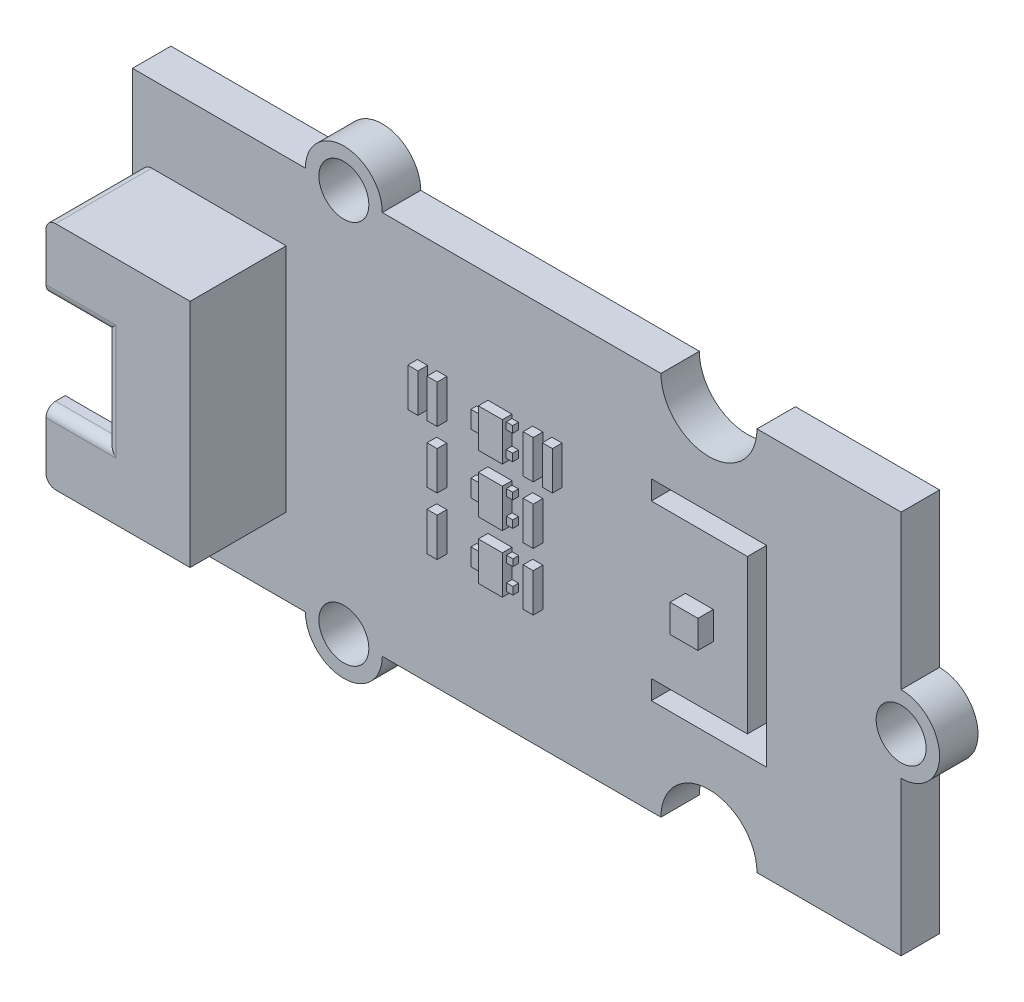
from build123d import *

# Parameters (mm, degrees)
SKETCH1_R           = 1.3
BOSS_EXTRUDE1_DEPTH = 2
BOSS_EXTRUDE2_DEPTH = 5
SKETCH3_W           = 4
SKETCH3_H           = 10
CUT_EXTRUDE1_DEPTH  = 7
SKETCH4_W           = 5
SKETCH4_H           = 12
CUT_EXTRUDE2_DEPTH  = 0.5
CUT_EXTRUDE3_DEPTH  = 1.5
FILLET1_R           = 0.5
SKETCH6_W           = 1.450763296
SKETCH6_H           = 1.450763296
BOSS_EXTRUDE3_DEPTH = 0.8
SKETCH7_W           = 0.528041157
SKETCH7_H           = 2.003611801
BOSS_EXTRUDE4_DEPTH = 0.5
SKETCH8_W           = 1.250632541
SKETCH8_H           = 2.003611801
BOSS_EXTRUDE5_DEPTH = 0.5
SKETCH9_W           = 0.587023474
SKETCH9_H           = 0.894026868
SKETCH9_W_2         = 0.333695167
SKETCH9_H_2         = 0.350698787
SKETCH9_W_3         = 0.333695166
SKETCH9_H_3         = 0.390012219
SKETCH9_H_4         = 0.39001222
SKETCH9_H_5         = 0.350698788
BOSS_EXTRUDE6_DEPTH = 0.3


with BuildPart() as part:
    # Sketch1 → Boss-Extrude1 (new body)
    with BuildSketch(Plane.XY):
        with BuildLine():
            Line((0, 0), (9, 0))
            ThreePointArc((9, 0), (11, -2), (13, 0))
            Line((13, 0), (27.5, 0))
            ThreePointArc((27.5, 0), (30, 2.5), (32.5, 0))
            Line((32.5, 0), (40, 0))
            Line((40, 0), (40, 8))
            ThreePointArc((40, 8), (42, 10), (40, 12))
            Line((40, 12), (40, 20))
            Line((40, 20), (32.5, 20))
            ThreePointArc((32.5, 20), (30, 17.5), (27.5, 20))
            Line((27.5, 20), (13, 20))
            ThreePointArc((13, 20), (11, 22), (9, 20))
            Line((9, 20), (0, 20))
            Line((0, 20), (0, 0))
        make_face()
        with Locations((11, 20)):
            Circle(SKETCH1_R, mode=Mode.SUBTRACT)
        with Locations((11, 0)):
            Circle(SKETCH1_R, mode=Mode.SUBTRACT)
        with Locations((40, 10)):
            Circle(SKETCH1_R, mode=Mode.SUBTRACT)
        Polygon((33, 15), (27, 15), (27, 14), (32, 14), (32, 6), (27, 6), (27, 5), (33, 5), align=None, mode=Mode.SUBTRACT)
    extrude(amount=BOSS_EXTRUDE1_DEPTH)

    # Sketch2 → Boss-Extrude2 (add)
    with BuildSketch(Plane.XY.offset(2)):
        Polygon((0, 10), (0, 16), (8, 16), (8, 4), (0, 4), align=None)
    extrude(amount=BOSS_EXTRUDE2_DEPTH)

    # Sketch3 → Cut-Extrude1 (cut)
    with BuildSketch(Plane.ZY):
        with Locations((4, 10)):
            Rectangle(SKETCH3_W, SKETCH3_H)
    extrude(amount=-CUT_EXTRUDE1_DEPTH, mode=Mode.SUBTRACT)

    # Sketch4 → Cut-Extrude2 (cut)
    with BuildSketch(Plane.ZY):
        with Locations((4.5, 10)):
            Rectangle(SKETCH4_W, SKETCH4_H)
    extrude(amount=-CUT_EXTRUDE2_DEPTH, mode=Mode.SUBTRACT)

    # Sketch5 → Cut-Extrude3 (cut)
    with BuildSketch(Plane.XY.offset(7)):
        Polygon((3.638822155, 12.5), (0.5, 12.5), (0.5, 10), (0.5, 7.5), (3.638822155, 7.5), align=None)
    extrude(amount=-CUT_EXTRUDE3_DEPTH, mode=Mode.SUBTRACT)

    # Fillet1
    fillet1_edges = [part.edges().sort_by_distance(p)[0] for p in [
        (0.5, 4, 4.5),
        (0.5, 16, 4.5),
        (2.069411077, 7.5, 7),
        (3.638822155, 10, 7),
        (2.069411077, 12.5, 7),
    ]]
    fillet(fillet1_edges, radius=FILLET1_R)

    # Sketch6 → Boss-Extrude3 (add)
    with BuildSketch(Plane.XY.offset(2)):
        with Locations((29.5, 10)):
            Rectangle(SKETCH6_W, SKETCH6_H)
    extrude(amount=BOSS_EXTRUDE3_DEPTH)

    # Sketch7 → Boss-Extrude4 (add)
    with BuildSketch(Plane.XY.offset(2)):
        with Locations((16.091644497, 13.2872497)):
            Rectangle(SKETCH7_W, SKETCH7_H)
        with Locations((15.091644497, 13.2872497)):
            Rectangle(SKETCH7_W, SKETCH7_H)
        with Locations((16.091644497, 10.2872497)):
            Rectangle(SKETCH7_W, SKETCH7_H)
        with Locations((16.091644497, 7.2872497)):
            Rectangle(SKETCH7_W, SKETCH7_H)
        with Locations((22.091644497, 13.2872497)):
            Rectangle(SKETCH7_W, SKETCH7_H)
        with Locations((21.091644497, 13.2872497)):
            Rectangle(SKETCH7_W, SKETCH7_H)
        with Locations((21.091644497, 10.2872497)):
            Rectangle(SKETCH7_W, SKETCH7_H)
        with Locations((21.091644497, 7.2872497)):
            Rectangle(SKETCH7_W, SKETCH7_H)
    extrude(amount=BOSS_EXTRUDE4_DEPTH)

    # Sketch8 → Boss-Extrude5 (add)
    with BuildSketch(Plane.XY.offset(2)):
        with Locations((19.1224917, 10.2872497)):
            Rectangle(SKETCH8_W, SKETCH8_H)
        with Locations((19.1224917, 13.2872497)):
            Rectangle(SKETCH8_W, SKETCH8_H)
        with Locations((19.1224917, 7.2872497)):
            Rectangle(SKETCH8_W, SKETCH8_H)
    extrude(amount=BOSS_EXTRUDE5_DEPTH)

    # Sketch9 → Boss-Extrude6 (add)
    with BuildSketch(Plane.XY.offset(2)):
        with Locations((18.203663692, 13.292407159)):
            Rectangle(SKETCH9_W, SKETCH9_H)
        with Locations((18.203663692, 10.192407159)):
            Rectangle(SKETCH9_W, SKETCH9_H)
        with Locations((18.203663692, 7.092407159)):
            Rectangle(SKETCH9_W, SKETCH9_H)
        with Locations((19.914655554, 13.914769987)):
            Rectangle(SKETCH9_W_2, SKETCH9_H_2)
        with Locations((19.921649724, 9.650395769)):
            Rectangle(SKETCH9_W_3, SKETCH9_H_3)
        with Locations((19.914655554, 12.650387615)):
            Rectangle(SKETCH9_W_2, SKETCH9_H_4)
        with Locations((19.921649724, 10.91477814)):
            Rectangle(SKETCH9_W_3, SKETCH9_H_5)
        with Locations((19.928643894, 6.650403922)):
            Rectangle(SKETCH9_W_3, SKETCH9_H_3)
        with Locations((19.928643894, 7.914786293)):
            Rectangle(SKETCH9_W_3, SKETCH9_H_5)
    extrude(amount=BOSS_EXTRUDE6_DEPTH)


solid = part.part
